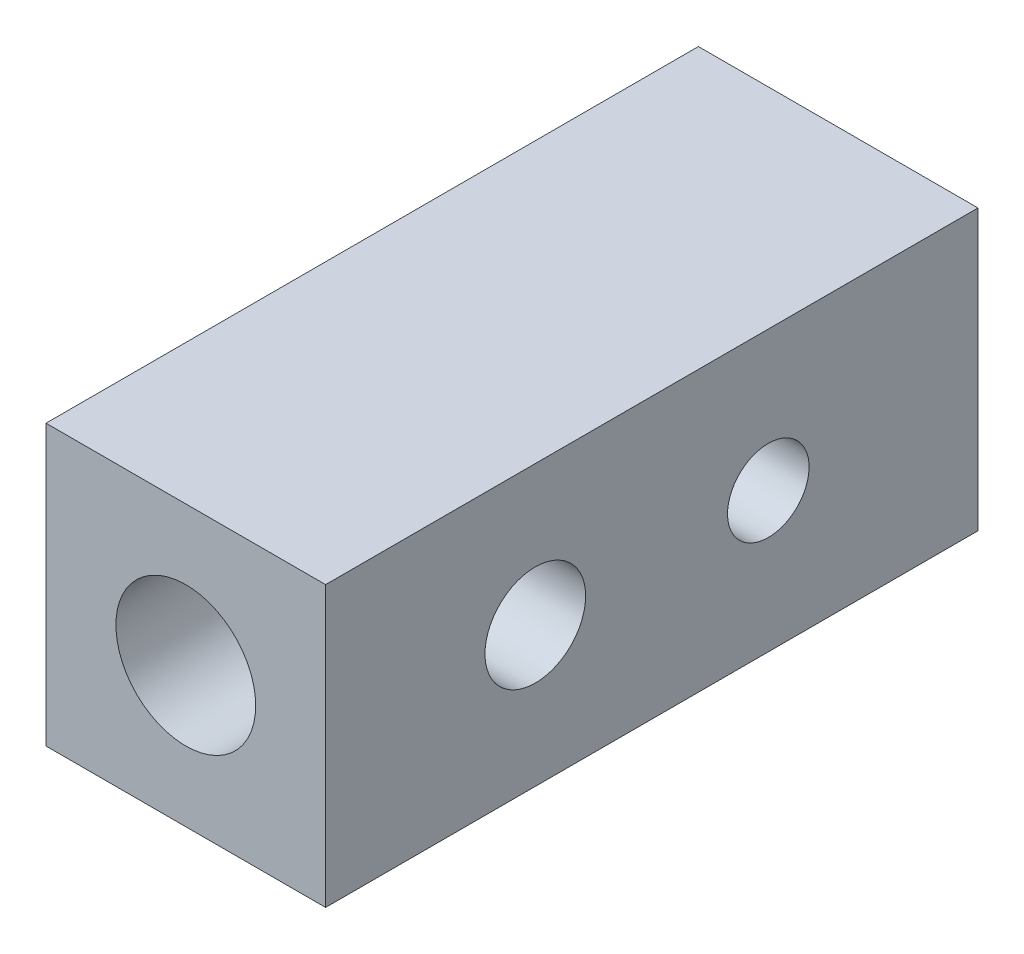
from build123d import *

# Parameters (mm, degrees)
SKETCH1_W           = 38.1
SKETCH1_H           = 38.1
SKETCH1_R           = 9.525
BOSS_EXTRUDE1_DEPTH = 44.45
SKETCH2_R           = 6.858
CUT_EXTRUDE1_DEPTH  = 62.565534189
SKETCH3_R           = 5.55625
CUT_EXTRUDE2_DEPTH  = 19.05
SKETCH4_R           = 6.858
CUT_EXTRUDE3_DEPTH  = 19.05


with BuildPart() as part:
    # Sketch1 → Boss-Extrude1 (new, symmetric)
    with BuildSketch(Plane.XY):
        Rectangle(SKETCH1_W, SKETCH1_H)
        Circle(SKETCH1_R, mode=Mode.SUBTRACT)
    extrude(amount=BOSS_EXTRUDE1_DEPTH, both=True)

    # Sketch2 → Cut-Extrude1 (cut, through all)
    with BuildSketch(Plane(origin=(19.05, 0, 0), x_dir=(0, 0, -1), z_dir=(1, 0, 0))):
        with Locations(Location((-15.875, 0, 0), (0, 0, 90))):
            Circle(SKETCH2_R)
    extrude(amount=-CUT_EXTRUDE1_DEPTH, mode=Mode.SUBTRACT)

    # Sketch3 → Cut-Extrude2 (cut)
    with BuildSketch(Plane(origin=(19.05, 0, 0), x_dir=(0, 0, -1), z_dir=(1, 0, 0))):
        with Locations(Location((15.875, 0, 0), (0, 0, 90))):
            Circle(SKETCH3_R)
    extrude(amount=-CUT_EXTRUDE2_DEPTH, mode=Mode.SUBTRACT)

    # Sketch4 → Cut-Extrude3 (cut)
    with BuildSketch(Plane.ZY.offset(19.05)):
        with Locations(Location((-15.875, 0, 0), (0, 0, 270))):
            Circle(SKETCH4_R)
    extrude(amount=-CUT_EXTRUDE3_DEPTH, mode=Mode.SUBTRACT)


solid = part.part
